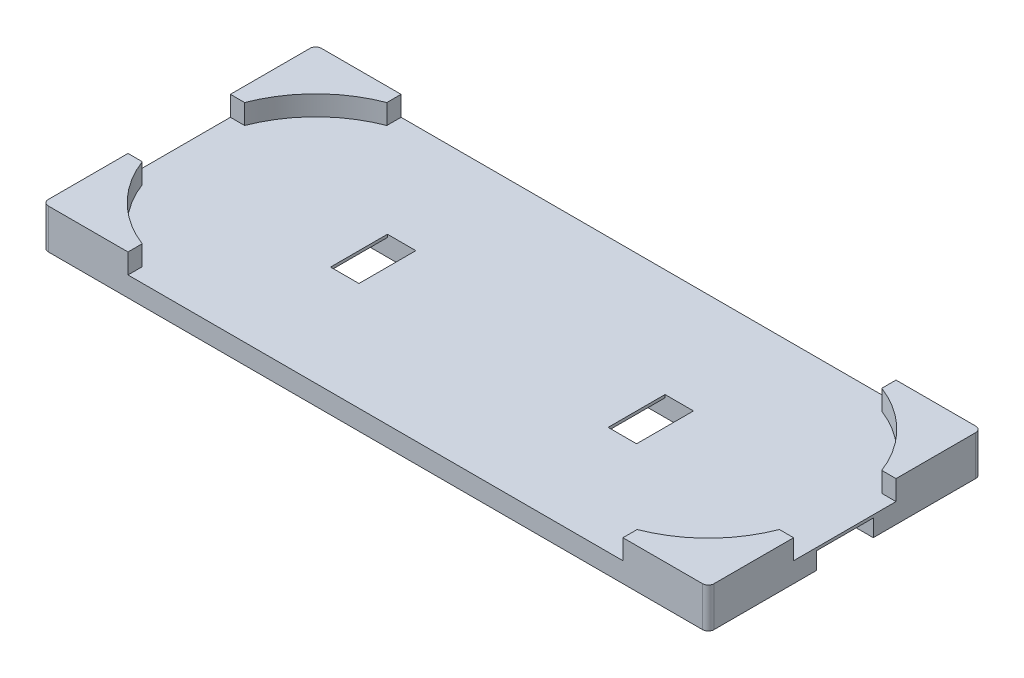
from build123d import *

# Parameters (mm, degrees)
SKETCH1_W           = 11.7
SKETCH1_H           = 4.8
BOSS_EXTRUDE1_DEPTH = 0.35
SKETCH2_W           = 4
SKETCH2_H           = 1
CUT_EXTRUDE2_DEPTH  = 0.3
BOSS_EXTRUDE3_DEPTH = 0.35
FILLET2_R           = 0.1
SKETCH6_W           = 0.5
SKETCH6_H           = 1
CUT_EXTRUDE3_DEPTH  = 1


with BuildPart() as part:
    # Sketch1 → Boss-Extrude1 (new body)
    with BuildSketch(Plane(origin=(0, 0, 0), x_dir=(1, 0, 0), z_dir=(0, 1, 0))):
        Rectangle(SKETCH1_W, SKETCH1_H)
    extrude(amount=BOSS_EXTRUDE1_DEPTH)

    # Sketch2 → Cut-Extrude2 (cut)
    with BuildSketch(Plane.XZ):
        with Locations((-3.85, 0)):
            Rectangle(SKETCH2_W, SKETCH2_H)
        with Locations((3.85, 0)):
            Rectangle(SKETCH2_W, SKETCH2_H)
    extrude(amount=-CUT_EXTRUDE2_DEPTH, mode=Mode.SUBTRACT)

    # Sketch4 → Boss-Extrude3 (add)
    with BuildSketch(Plane(origin=(0, 0.35, 0), x_dir=(1, 0, 0), z_dir=(0, 1, 0))):
        with BuildLine():
            Line((-4.35, 2.15), (-4.35, 2.4))
            Line((-4.35, 2.4), (-5.85, 2.4))
            Line((-5.85, 2.4), (-5.85, 0.9))
            Line((-5.85, 0.9), (-5.6, 0.9))
            ThreePointArc((-5.6, 0.9), (-5.107388458, 1.657388458), (-4.35, 2.15))
        make_face()
        with BuildLine():
            Line((5.85, 2.4), (4.35, 2.4))
            Line((4.35, 2.4), (4.35, 2.15))
            ThreePointArc((4.35, 2.15), (5.107388458, 1.657388458), (5.6, 0.9))
            Line((5.6, 0.9), (5.85, 0.9))
            Line((5.85, 0.9), (5.85, 2.4))
        make_face()
        with BuildLine():
            Line((4.35, -2.15), (4.35, -2.4))
            Line((4.35, -2.4), (5.85, -2.4))
            Line((5.85, -2.4), (5.85, -0.9))
            Line((5.85, -0.9), (5.6, -0.9))
            ThreePointArc((5.6, -0.9), (5.107388458, -1.657388458), (4.35, -2.15))
        make_face()
        with BuildLine():
            Line((-5.85, -2.4), (-4.35, -2.4))
            Line((-4.35, -2.4), (-4.35, -2.15))
            ThreePointArc((-4.35, -2.15), (-5.107388458, -1.657388458), (-5.6, -0.9))
            Line((-5.6, -0.9), (-5.85, -0.9))
            Line((-5.85, -0.9), (-5.85, -2.4))
        make_face()
    extrude(amount=BOSS_EXTRUDE3_DEPTH)

    # Fillet2
    fillet2_edges = [part.edges().sort_by_distance(p)[0] for p in [
        (5.85, 0.35, 2.4),
        (-5.85, 0.35, 2.4),
        (-5.85, 0.35, -2.4),
        (5.85, 0.35, -2.4),
    ]]
    fillet(fillet2_edges, radius=FILLET2_R)

    # Sketch6 → Cut-Extrude3 (cut)
    with BuildSketch(Plane.XZ.offset(-0.3)):
        with Locations((2.44, 0)):
            Rectangle(SKETCH6_W, SKETCH6_H)
        with Locations((-2.44, 0)):
            Rectangle(SKETCH6_W, SKETCH6_H)
    extrude(amount=-CUT_EXTRUDE3_DEPTH, mode=Mode.SUBTRACT)


solid = part.part
